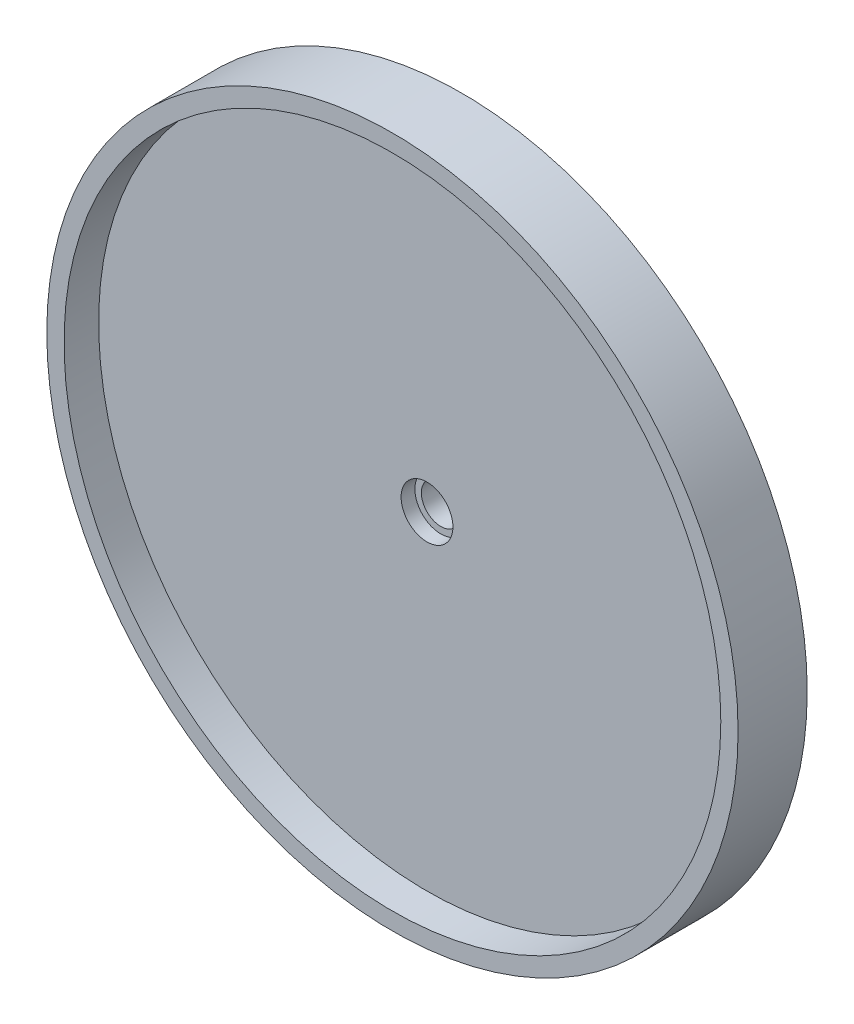
from build123d import *

# Parameters (mm, degrees)
CUT_EXTRUDE1_REACH             = 92.696
SKETCH3_R                      = 3.571875
CUT_EXTRUDE1_DIRECTION_2_DEPTH = 91.696141042
SKETCH4_R                      = 4.7625
CUT_EXTRUDE2_DEPTH             = 2.54


with BuildPart() as part:
    # Sketch2 → Revolve1 (revolve)
    with BuildSketch(Plane(origin=(0, 0, 0), x_dir=(0, 0, -1), z_dir=(1, 0, 0)), mode=Mode.PRIVATE) as revolve1_sk:
        Polygon((0, 63.5), (0, 60.325), (6.35, 60.325), (6.35, 0), (12.7, 0), (12.7, 63.5), align=None)
    revolve(revolve1_sk.sketch.rotate(Axis((0, 0, 40.533532934), (0, 0, -1)), 90), axis=Axis((0, 0, 40.533532934), (0, 0, -1)))

    # Sketch3 → Cut-Extrude1 (cut, up to next)
    with BuildSketch(Plane(origin=(0, 0, -12.7), x_dir=(-1, 0, 0), z_dir=(0, 0, -1)), mode=Mode.PRIVATE) as cut_extrude1_sk1:
        with Locations(Location((0, 0, 0), (0, 0, 180))):
            Circle(SKETCH3_R)
    cut_extrude1_tool1 = extrude(cut_extrude1_sk1.sketch, amount=-CUT_EXTRUDE1_REACH, mode=Mode.PRIVATE) & part.part
    add(cut_extrude1_tool1.solids().sort_by_distance((0, 0, -12.7))[0], mode=Mode.SUBTRACT)

    # Sketch3 → Cut-Extrude1 direction 2 (cut)
    with BuildSketch(Plane(origin=(0, 0, -12.7), x_dir=(-1, 0, 0), z_dir=(0, 0, -1))):
        with Locations(Location((0, 0, 0), (0, 0, 180))):
            Circle(SKETCH3_R)
    extrude(amount=CUT_EXTRUDE1_DIRECTION_2_DEPTH, mode=Mode.SUBTRACT)

    # Sketch4 → Cut-Extrude2 (cut)
    with BuildSketch(Plane.XY.offset(-6.35)):
        Circle(SKETCH4_R)
    extrude(amount=-CUT_EXTRUDE2_DEPTH, mode=Mode.SUBTRACT)


solid = part.part
